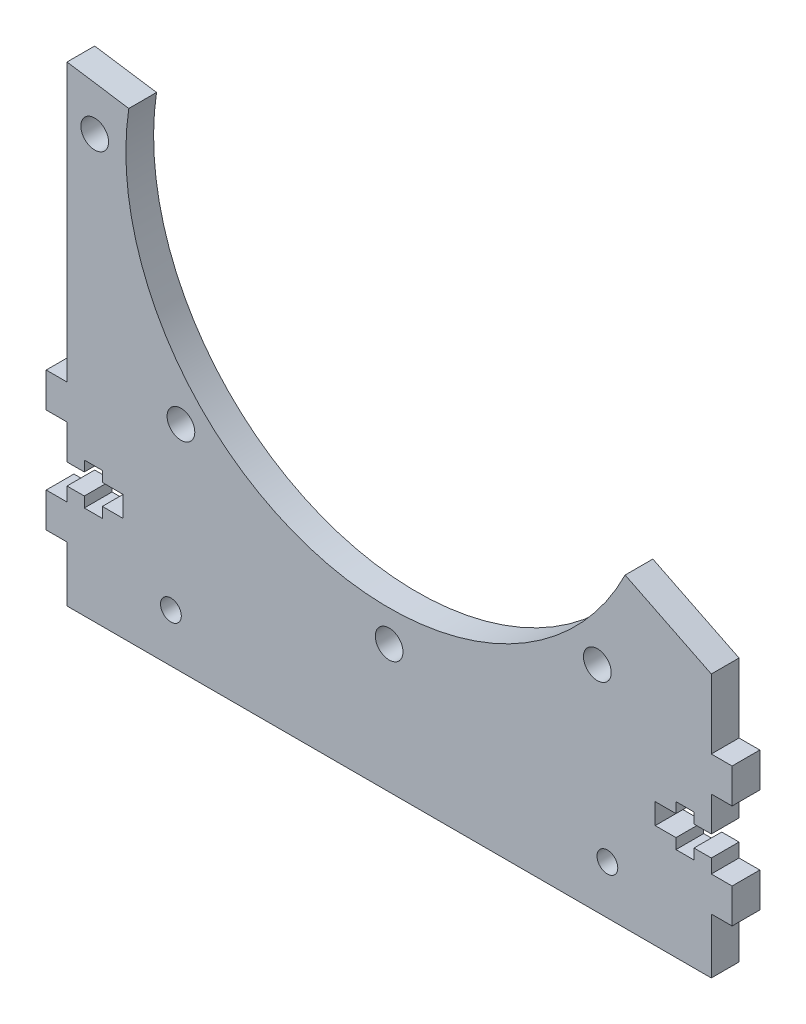
from build123d import *

# Parameters (mm, degrees)
SKETCH_3_R      = 1.5
SKETCH_3_R_2    = 2
EXTRUDE_1_DEPTH = 4


with BuildPart() as part:
    # 草图3 → 凸台-拉伸1 (new body)
    with BuildSketch(Plane.XY):
        with BuildLine():
            Line((-46.5, -7.990216685), (46.5, -7.990216685))
            Line((46.5, -7.990216685), (46.5, 0.009783315))
            Line((46.5, 0.009783315), (49.5, 0.009783315))
            Line((49.5, 0.009783315), (49.5, 5.009783315))
            Line((49.5, 5.009783315), (46.5, 5.009783315))
            Line((46.5, 5.009783315), (46.5, 7.009783315))
            Line((46.5, 7.009783315), (44, 7.009783315))
            Line((44, 7.009783315), (44, 5.509783315))
            Line((44, 5.509783315), (41.4, 5.509783315))
            Line((41.4, 5.509783315), (41.4, 7.009783315))
            Line((41.4, 7.009783315), (38.4, 7.009783315))
            Line((38.4, 7.009783315), (38.4, 10.009783315))
            Line((38.4, 10.009783315), (41.4, 10.009783315))
            Line((41.4, 10.009783315), (41.4, 11.509783315))
            Line((41.4, 11.509783315), (44, 11.509783315))
            Line((44, 11.509783315), (44, 10.009783315))
            Line((44, 10.009783315), (46.5, 10.009783315))
            Line((46.5, 10.009783315), (46.5, 15.009783315))
            Line((46.5, 15.009783315), (49.5, 15.009783315))
            Line((49.5, 15.009783315), (49.5, 20.009783315))
            Line((49.5, 20.009783315), (46.5, 20.009783315))
            Line((46.5, 20.009783315), (46.5, 30.009783315))
            Line((46.5, 30.009783315), (34.06116735, 36.162324196))
            ThreePointArc((34.06116735, 36.162324196), (-11.38853896, 16.756491321), (-37.576612526, 58.666477673))
            Line((-37.576612526, 58.666477673), (-46.5, 60.009783315))
            Line((-46.5, 60.009783315), (-46.5, 20.009783315))
            Line((-46.5, 20.009783315), (-49.5, 20.009783315))
            Line((-49.5, 20.009783315), (-49.5, 15.009783315))
            Line((-49.5, 15.009783315), (-46.5, 15.009783315))
            Line((-46.5, 15.009783315), (-46.5, 10.009783315))
            Line((-46.5, 10.009783315), (-44, 10.009783315))
            Line((-44, 10.009783315), (-44, 11.509783315))
            Line((-44, 11.509783315), (-41.4, 11.509783315))
            Line((-41.4, 11.509783315), (-41.4, 10.009783315))
            Line((-41.4, 10.009783315), (-38.4, 10.009783315))
            Line((-38.4, 10.009783315), (-38.4, 7.009783315))
            Line((-38.4, 7.009783315), (-41.4, 7.009783315))
            Line((-41.4, 7.009783315), (-41.4, 5.509783315))
            Line((-41.4, 5.509783315), (-44, 5.509783315))
            Line((-44, 5.509783315), (-44, 7.009783315))
            Line((-44, 7.009783315), (-46.5, 7.009783315))
            Line((-46.5, 7.009783315), (-46.5, 5.009783315))
            Line((-46.5, 5.009783315), (-49.5, 5.009783315))
            Line((-49.5, 5.009783315), (-49.5, 0.009783315))
            Line((-49.5, 0.009783315), (-46.5, 0.009783315))
            Line((-46.5, 0.009783315), (-46.5, -7.990216685))
        make_face()
        with Locations((-31.5, -0.990216685)):
            Circle(SKETCH_3_R, mode=Mode.SUBTRACT)
        with Locations((31.5, -0.990216685)):
            Circle(SKETCH_3_R, mode=Mode.SUBTRACT)
        with Locations((0, 10.509783315)):
            Circle(SKETCH_3_R_2, mode=Mode.SUBTRACT)
        with Locations((-30.0520382, 22.957745114)):
            Circle(SKETCH_3_R_2, mode=Mode.SUBTRACT)
        with Locations((-42.5, 53.009783315)):
            Circle(SKETCH_3_R_2, mode=Mode.SUBTRACT)
        with Locations((30.0520382, 22.957745114)):
            Circle(SKETCH_3_R_2, mode=Mode.SUBTRACT)
    extrude(amount=EXTRUDE_1_DEPTH)


solid = part.part
